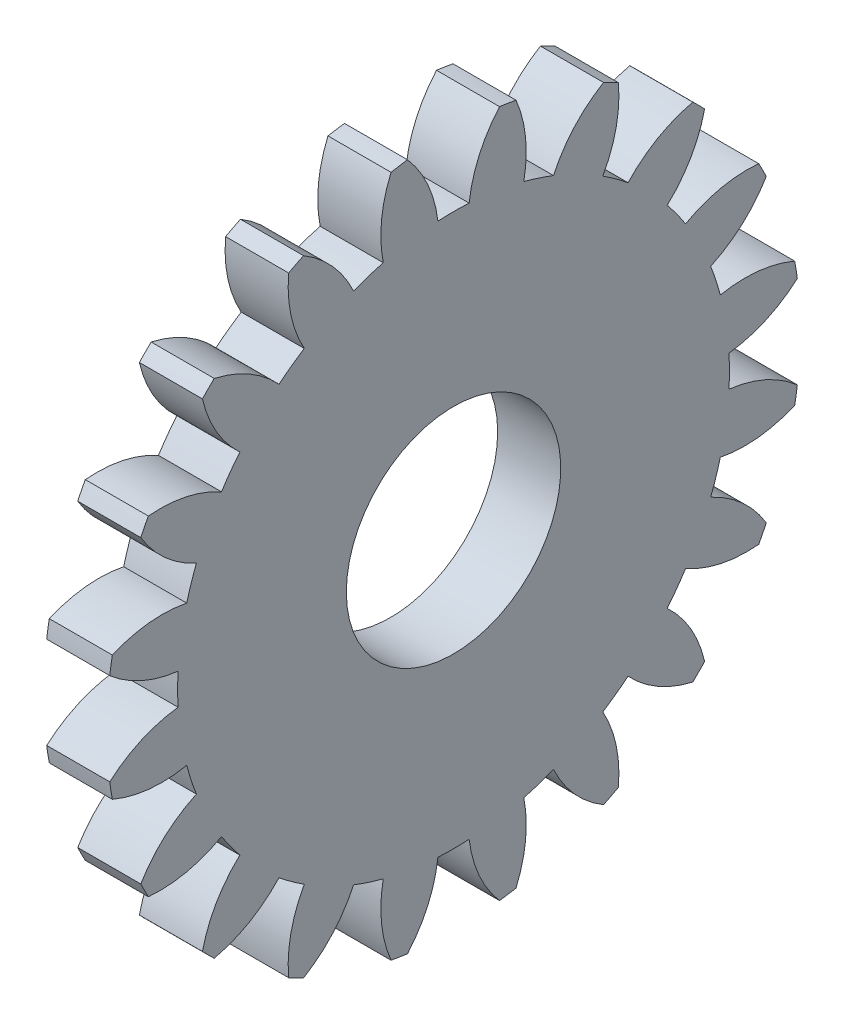
from build123d import *

# Parameters (mm, degrees)
BASPROSKE_W     = 5
BASPROSKE_H     = 27.5
TOOTHCUT_DEPTH  = 40.210967853
TEETHCUTS_COUNT = 20
TEETHCUTS_ANGLE = 342
BORSKE_R        = 8.5
BORE_DEPTH      = 50.0000508


with BuildPart() as part:
    # BasProSke → Base-Revolve (revolve)
    with BuildSketch(Plane(origin=(0, 0, 0), x_dir=(1, 0, 0), z_dir=(0, 1, 0)), mode=Mode.PRIVATE) as base_revolve_sk:
        with Locations((2.5, 13.75)):
            Rectangle(BASPROSKE_W, BASPROSKE_H)
    revolve(base_revolve_sk.sketch.rotate(Axis((-10, 0, 0), (1, 0, 0)), 180), axis=Axis((-10, 0, 0), (1, 0, 0)))

    # TooCutSke → ToothCut (cut, through all)
    with BuildSketch(Plane(origin=(0, 0, 0), x_dir=(0, 0, -1), z_dir=(1, 0, 0))):
        with BuildLine():
            ThreePointArc((1.237725267, 21.838954008), (0, 21.874), (-1.237725267, 21.838954008))
            ThreePointArc((-1.237725267, 21.838954008), (-2.037783758, 24.744650423), (-3.667234079, 27.280011719))
            ThreePointArc((-3.667234079, 27.280011719), (0, 27.5254), (3.667234079, 27.280011719))
            ThreePointArc((3.667234079, 27.280011719), (2.037783758, 24.744650423), (1.237725267, 21.838954008))
        make_face()
    toothcut = extrude(amount=TOOTHCUT_DEPTH, mode=Mode.SUBTRACT)

    # TeethCuts: ToothCut ×20 about axis
    teethcuts_axis = Axis((-10, 0, 0), (1, 0, 0))
    for i in range(1, TEETHCUTS_COUNT):
        add(toothcut.rotate(teethcuts_axis, i * TEETHCUTS_ANGLE / (TEETHCUTS_COUNT - 1)), mode=Mode.SUBTRACT)

    # BorSke → Bore (cut, symmetric)
    with BuildSketch(Plane(origin=(0, 0, 0), x_dir=(0, 0, -1), z_dir=(1, 0, 0))):
        with Locations(Location((0, 0, 0), (0, 0, 180))):
            Circle(BORSKE_R)
    extrude(amount=BORE_DEPTH, both=True, mode=Mode.SUBTRACT)


solid = part.part
